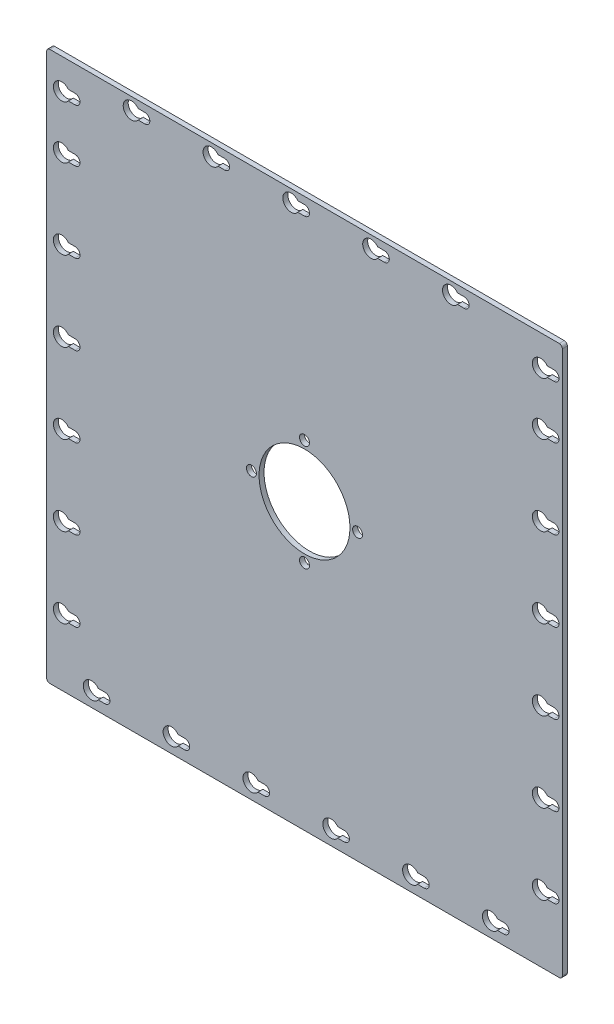
from build123d import *

# Parameters (mm, degrees)
SKETCH1_W           = 164.1
SKETCH1_H           = 174.745
SKETCH1_R           = 1.5875
SKETCH1_R_2         = 14.462
BOSS_EXTRUDE1_DEPTH = 1.5875
FILLET1_R           = 1


with BuildPart() as part:
    # Sketch1 → Boss-Extrude1 (new body)
    with BuildSketch(Plane.XY):
        with Locations((82.55, -87.3725)):
            Rectangle(SKETCH1_W, SKETCH1_H)
        with BuildLine():
            Line((16.934372699, -168.395), (19.05, -168.395))
            ThreePointArc((19.05, -168.395), (20.6375, -169.9825), (19.05, -171.57))
            Line((19.05, -171.57), (16.934372699, -171.57))
            ThreePointArc((16.934372699, -171.57), (12.1625, -169.9825), (16.934372699, -168.395))
        make_face(mode=Mode.SUBTRACT)
        with BuildLine():
            Line((7.409372699, -151.9325), (9.525, -151.9325))
            ThreePointArc((9.525, -151.9325), (11.1125, -153.52), (9.525, -155.1075))
            Line((9.525, -155.1075), (7.409372699, -155.1075))
            ThreePointArc((7.409372699, -155.1075), (2.6375, -153.52), (7.409372699, -151.9325))
        make_face(mode=Mode.SUBTRACT)
        with BuildLine():
            Line((42.334372699, -168.395), (44.45, -168.395))
            ThreePointArc((44.45, -168.395), (46.0375, -169.9825), (44.45, -171.57))
            Line((44.45, -171.57), (42.334372699, -171.57))
            ThreePointArc((42.334372699, -171.57), (37.5625, -169.9825), (42.334372699, -168.395))
        make_face(mode=Mode.SUBTRACT)
        with BuildLine():
            Line((67.734372699, -168.395), (69.85, -168.395))
            ThreePointArc((69.85, -168.395), (71.4375, -169.9825), (69.85, -171.57))
            Line((69.85, -171.57), (67.734372699, -171.57))
            ThreePointArc((67.734372699, -171.57), (62.9625, -169.9825), (67.734372699, -168.395))
        make_face(mode=Mode.SUBTRACT)
        with BuildLine():
            Line((7.409372699, -126.5325), (9.525, -126.5325))
            ThreePointArc((9.525, -126.5325), (11.1125, -128.12), (9.525, -129.7075))
            Line((9.525, -129.7075), (7.409372699, -129.7075))
            ThreePointArc((7.409372699, -129.7075), (2.6375, -128.12), (7.409372699, -126.5325))
        make_face(mode=Mode.SUBTRACT)
        with BuildLine():
            Line((7.409372699, -101.1325), (9.525, -101.1325))
            ThreePointArc((9.525, -101.1325), (11.1125, -102.72), (9.525, -104.3075))
            Line((9.525, -104.3075), (7.409372699, -104.3075))
            ThreePointArc((7.409372699, -104.3075), (2.6375, -102.72), (7.409372699, -101.1325))
        make_face(mode=Mode.SUBTRACT)
        with BuildLine():
            Line((93.134372699, -168.395), (95.25, -168.395))
            ThreePointArc((95.25, -168.395), (96.8375, -169.9825), (95.25, -171.57))
            Line((95.25, -171.57), (93.134372699, -171.57))
            ThreePointArc((93.134372699, -171.57), (88.3625, -169.9825), (93.134372699, -168.395))
        make_face(mode=Mode.SUBTRACT)
        with BuildLine():
            Line((118.534372699, -168.395), (120.65, -168.395))
            ThreePointArc((120.65, -168.395), (122.2375, -169.9825), (120.65, -171.57))
            Line((120.65, -171.57), (118.534372699, -171.57))
            ThreePointArc((118.534372699, -171.57), (113.7625, -169.9825), (118.534372699, -168.395))
        make_face(mode=Mode.SUBTRACT)
        with BuildLine():
            Line((143.934372699, -168.395), (146.05, -168.395))
            ThreePointArc((146.05, -168.395), (147.6375, -169.9825), (146.05, -171.57))
            Line((146.05, -171.57), (143.934372699, -171.57))
            ThreePointArc((143.934372699, -171.57), (139.1625, -169.9825), (143.934372699, -168.395))
        make_face(mode=Mode.SUBTRACT)
        with BuildLine():
            Line((159.809372699, -151.9325), (161.925, -151.9325))
            ThreePointArc((161.925, -151.9325), (163.5125, -153.52), (161.925, -155.1075))
            Line((161.925, -155.1075), (159.809372699, -155.1075))
            ThreePointArc((159.809372699, -155.1075), (155.0375, -153.52), (159.809372699, -151.9325))
        make_face(mode=Mode.SUBTRACT)
        with Locations((82.55, -100.966)):
            Circle(SKETCH1_R, mode=Mode.SUBTRACT)
        with BuildLine():
            Line((159.809372699, -126.5325), (161.925, -126.5325))
            ThreePointArc((161.925, -126.5325), (163.5125, -128.12), (161.925, -129.7075))
            Line((161.925, -129.7075), (159.809372699, -129.7075))
            ThreePointArc((159.809372699, -129.7075), (155.0375, -128.12), (159.809372699, -126.5325))
        make_face(mode=Mode.SUBTRACT)
        with BuildLine():
            Line((159.809372699, -101.1325), (161.925, -101.1325))
            ThreePointArc((161.925, -101.1325), (163.5125, -102.72), (161.925, -104.3075))
            Line((161.925, -104.3075), (159.809372699, -104.3075))
            ThreePointArc((159.809372699, -104.3075), (155.0375, -102.72), (159.809372699, -101.1325))
        make_face(mode=Mode.SUBTRACT)
        with BuildLine():
            Line((7.409372699, -75.7325), (9.525, -75.7325))
            ThreePointArc((9.525, -75.7325), (11.1125, -77.32), (9.525, -78.9075))
            Line((9.525, -78.9075), (7.409372699, -78.9075))
            ThreePointArc((7.409372699, -78.9075), (2.6375, -77.32), (7.409372699, -75.7325))
        make_face(mode=Mode.SUBTRACT)
        with BuildLine():
            Line((7.409372699, -50.3325), (9.525, -50.3325))
            ThreePointArc((9.525, -50.3325), (11.1125, -51.92), (9.525, -53.5075))
            Line((9.525, -53.5075), (7.409372699, -53.5075))
            ThreePointArc((7.409372699, -53.5075), (2.6375, -51.92), (7.409372699, -50.3325))
        make_face(mode=Mode.SUBTRACT)
        with Locations((65.659, -84.075)):
            Circle(SKETCH1_R, mode=Mode.SUBTRACT)
        with BuildLine():
            Line((7.409372699, -24.9325), (9.525, -24.9325))
            ThreePointArc((9.525, -24.9325), (11.1125, -26.52), (9.525, -28.1075))
            Line((9.525, -28.1075), (7.409372699, -28.1075))
            ThreePointArc((7.409372699, -28.1075), (2.6375, -26.52), (7.409372699, -24.9325))
        make_face(mode=Mode.SUBTRACT)
        with BuildLine():
            Line((7.409372699, -8.1), (9.525, -8.1))
            ThreePointArc((9.525, -8.1), (11.1125, -9.6875), (9.525, -11.275))
            Line((9.525, -11.275), (7.409372699, -11.275))
            ThreePointArc((7.409372699, -11.275), (2.6375, -9.6875), (7.409372699, -8.1))
        make_face(mode=Mode.SUBTRACT)
        with BuildLine():
            Line((29.634372699, -2.2625), (31.75, -2.2625))
            ThreePointArc((31.75, -2.2625), (33.3375, -3.85), (31.75, -5.4375))
            Line((31.75, -5.4375), (29.634372699, -5.4375))
            ThreePointArc((29.634372699, -5.4375), (24.8625, -3.85), (29.634372699, -2.2625))
        make_face(mode=Mode.SUBTRACT)
        with BuildLine():
            Line((55.034372699, -2.2625), (57.15, -2.2625))
            ThreePointArc((57.15, -2.2625), (58.7375, -3.85), (57.15, -5.4375))
            Line((57.15, -5.4375), (55.034372699, -5.4375))
            ThreePointArc((55.034372699, -5.4375), (50.2625, -3.85), (55.034372699, -2.2625))
        make_face(mode=Mode.SUBTRACT)
        with BuildLine():
            Line((80.434372699, -2.2625), (82.55, -2.2625))
            ThreePointArc((82.55, -2.2625), (84.1375, -3.85), (82.55, -5.4375))
            Line((82.55, -5.4375), (80.434372699, -5.4375))
            ThreePointArc((80.434372699, -5.4375), (75.6625, -3.85), (80.434372699, -2.2625))
        make_face(mode=Mode.SUBTRACT)
        with Locations((82.55, -84.075)):
            Circle(SKETCH1_R_2, mode=Mode.SUBTRACT)
        with Locations((99.441, -84.075)):
            Circle(SKETCH1_R, mode=Mode.SUBTRACT)
        with Locations((82.55, -67.184)):
            Circle(SKETCH1_R, mode=Mode.SUBTRACT)
        with BuildLine():
            Line((159.809372699, -75.7325), (161.925, -75.7325))
            ThreePointArc((161.925, -75.7325), (163.5125, -77.32), (161.925, -78.9075))
            Line((161.925, -78.9075), (159.809372699, -78.9075))
            ThreePointArc((159.809372699, -78.9075), (155.0375, -77.32), (159.809372699, -75.7325))
        make_face(mode=Mode.SUBTRACT)
        with BuildLine():
            Line((159.809372699, -50.3325), (161.925, -50.3325))
            ThreePointArc((161.925, -50.3325), (163.5125, -51.92), (161.925, -53.5075))
            Line((161.925, -53.5075), (159.809372699, -53.5075))
            ThreePointArc((159.809372699, -53.5075), (155.0375, -51.92), (159.809372699, -50.3325))
        make_face(mode=Mode.SUBTRACT)
        with BuildLine():
            Line((105.834372699, -2.2625), (107.95, -2.2625))
            ThreePointArc((107.95, -2.2625), (109.5375, -3.85), (107.95, -5.4375))
            Line((107.95, -5.4375), (105.834372699, -5.4375))
            ThreePointArc((105.834372699, -5.4375), (101.0625, -3.85), (105.834372699, -2.2625))
        make_face(mode=Mode.SUBTRACT)
        with BuildLine():
            Line((159.809372699, -24.9325), (161.925, -24.9325))
            ThreePointArc((161.925, -24.9325), (163.5125, -26.52), (161.925, -28.1075))
            Line((161.925, -28.1075), (159.809372699, -28.1075))
            ThreePointArc((159.809372699, -28.1075), (155.0375, -26.52), (159.809372699, -24.9325))
        make_face(mode=Mode.SUBTRACT)
        with BuildLine():
            Line((131.234372699, -2.2625), (133.35, -2.2625))
            ThreePointArc((133.35, -2.2625), (134.9375, -3.85), (133.35, -5.4375))
            Line((133.35, -5.4375), (131.234372699, -5.4375))
            ThreePointArc((131.234372699, -5.4375), (126.4625, -3.85), (131.234372699, -2.2625))
        make_face(mode=Mode.SUBTRACT)
        with BuildLine():
            Line((159.809372699, -8.1), (161.925, -8.1))
            ThreePointArc((161.925, -8.1), (163.5125, -9.6875), (161.925, -11.275))
            Line((161.925, -11.275), (159.809372699, -11.275))
            ThreePointArc((159.809372699, -11.275), (155.0375, -9.6875), (159.809372699, -8.1))
        make_face(mode=Mode.SUBTRACT)
    extrude(amount=BOSS_EXTRUDE1_DEPTH)

    # Fillet1
    fillet1_edges = [part.edges().sort_by_distance(p)[0] for p in [
        (0.5, -174.745, 0.79375),
        (0.5, 0, 0.79375),
        (164.6, 0, 0.79375),
        (164.6, -174.745, 0.79375),
    ]]
    fillet(fillet1_edges, radius=FILLET1_R)


solid = part.part
